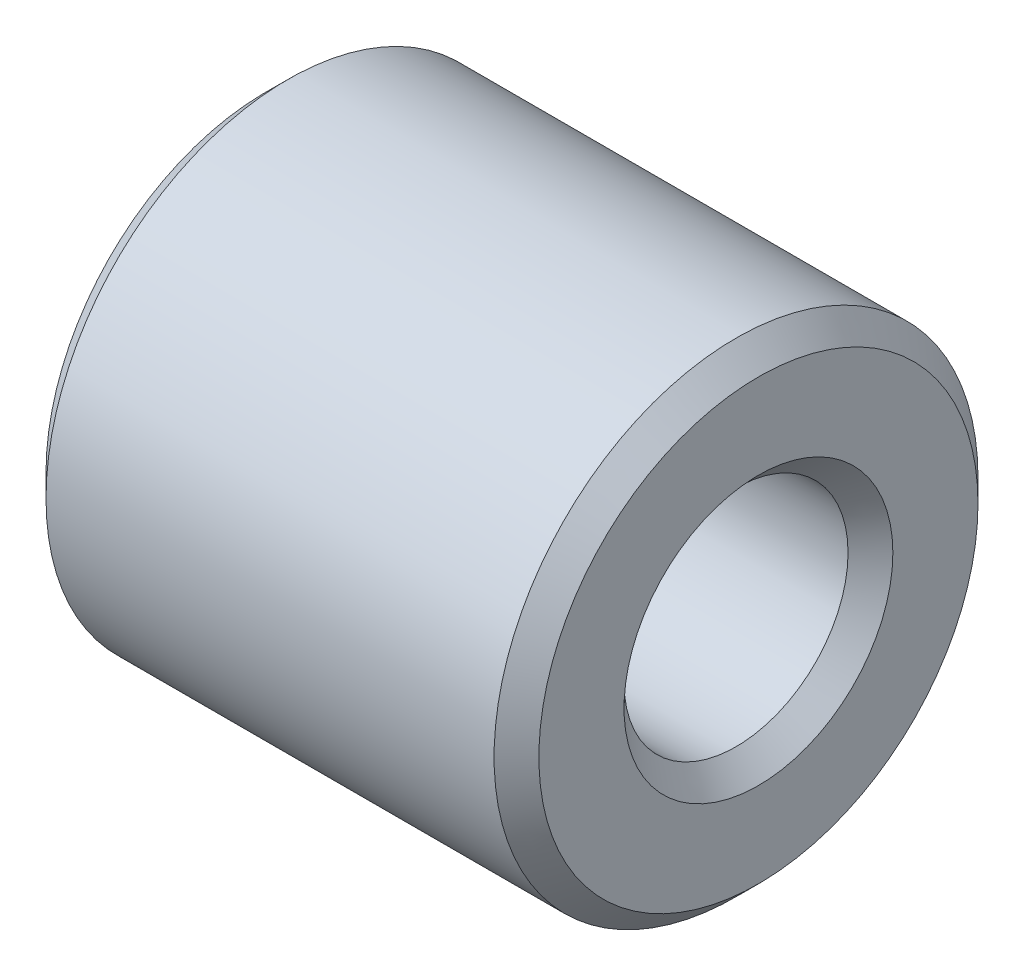
from build123d import *

# Parameters (mm, degrees)
SKETCH1_W          = 11
SKETCH1_H          = 2.9
SKETCH2_R          = 1.5
CUT_EXTRUDE1_DEPTH = 10
CHAMFER1_SIZE      = 0.5


with BuildPart() as part:
    # Sketch1 → Revolve1 (revolve)
    with BuildSketch(Plane.XY, mode=Mode.PRIVATE) as revolve1_sk:
        with Locations((0, 3.95)):
            Rectangle(SKETCH1_W, SKETCH1_H)
    revolve(revolve1_sk.sketch.rotate(Axis((0, 0, 0), (-1, 0, 0)), 90), axis=Axis((0, 0, 0), (-1, 0, 0)))

    # Sketch2 → Cut-Extrude1 (cut)
    with BuildSketch(Plane(origin=(0, 0, 0), x_dir=(1, 0, 0), z_dir=(0, 1, 0))):
        with Locations(Location((-2.75, 0, 0), (0, 0, 270))):
            Circle(SKETCH2_R)
    extrude(amount=-CUT_EXTRUDE1_DEPTH, mode=Mode.SUBTRACT)

    # Chamfer1
    chamfer1_edges = [part.edges().sort_by_distance(p)[0] for p in [
        (-5.5, 0, 5.4),
        (5.5, 0, 5.4),
        (5.5, 0, 2.5),
        (-5.5, 0, 2.5),
    ]]
    chamfer(chamfer1_edges, length=CHAMFER1_SIZE)


solid = part.part
